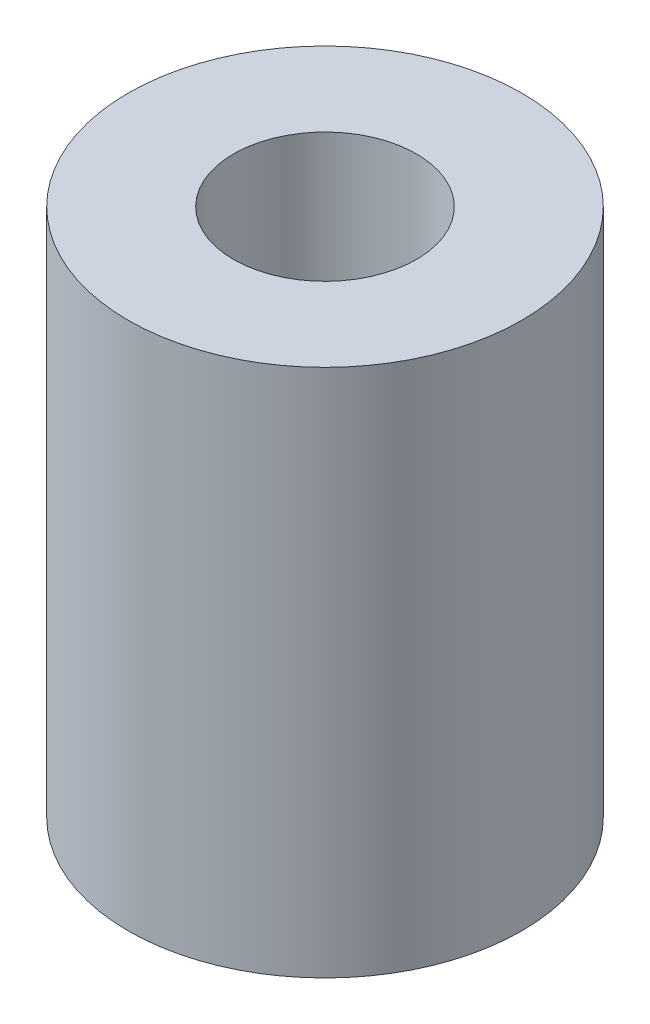
from build123d import *

# Parameters (mm, degrees)
SKETCH1_R           = 2.363
SKETCH1_R_2         = 1.098320384
BOSS_EXTRUDE1_DEPTH = 6.35


with BuildPart() as part:
    # Sketch1 → Boss-Extrude1 (new body)
    with BuildSketch(Plane(origin=(0, 0, 0), x_dir=(1, 0, 0), z_dir=(0, 1, 0))):
        with Locations(Location((0, 0, 0), (0, 0, 270))):
            Circle(SKETCH1_R)
        with Locations(Location((0, 0, 0), (0, 0, 270))):
            Circle(SKETCH1_R_2, mode=Mode.SUBTRACT)
    extrude(amount=BOSS_EXTRUDE1_DEPTH)


solid = part.part
